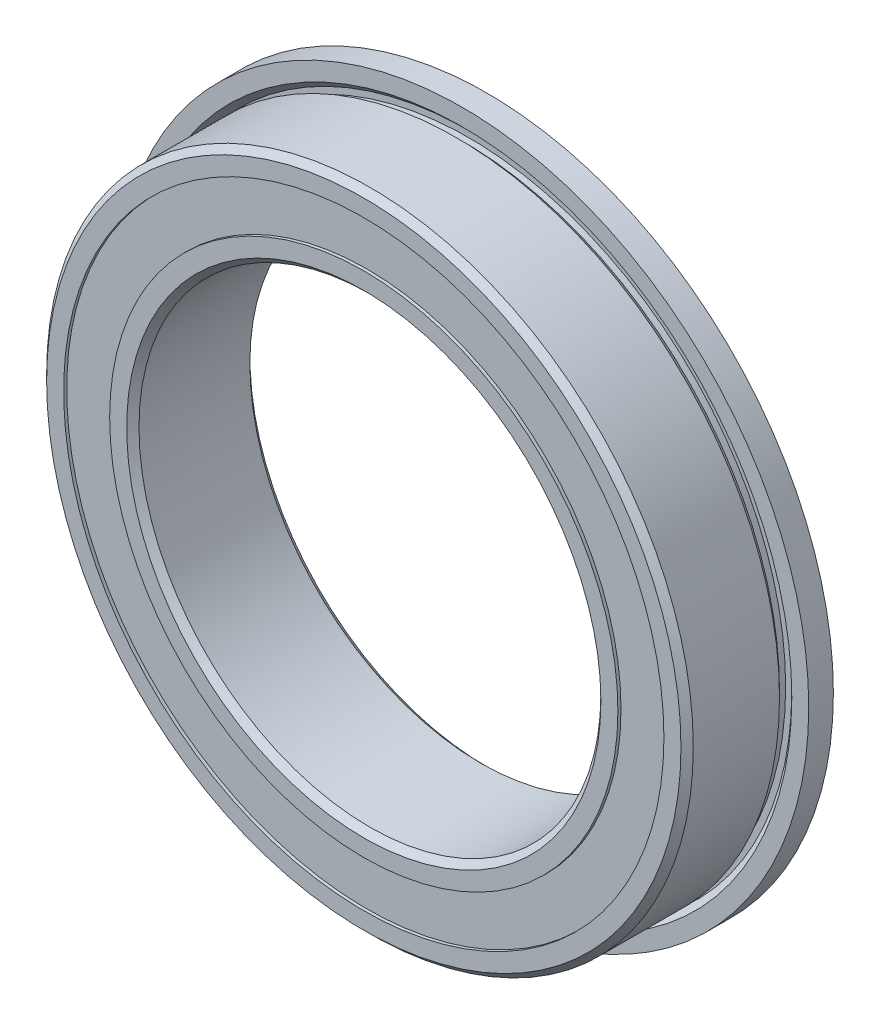
from build123d import *

# Parameters (mm, degrees)
SKETCH6_W         = 0.24908425
SKETCH6_H         = 0.747252748
CIRPATTERN1_COUNT = 13
SKETCH5_W         = 0.738746313
SKETCH5_H         = 1.494505494


with BuildPart() as part:
    # Sketch7 → Revolve7 (revolve)
    with BuildSketch(Plane(origin=(0, 0, 0), x_dir=(0, 0, -1), z_dir=(1, 0, 0))):
        with BuildLine():
            Line((2, 11.25), (1.2, 11.25))
            Line((1.2, 11.25), (1.2, 10.7))
            Line((1.2, 10.7), (1.4, 10.5))
            Line((1.4, 10.5), (1.4, 10.3))
            Line((1.4, 10.3), (1.2, 10.3))
            Line((1.2, 10.3), (1, 10.5))
            Line((1, 10.5), (-1.8, 10.5))
            Line((-1.8, 10.5), (-2, 10.3))
            Line((-2, 10.3), (-2, 9.747252747))
            Line((-2, 9.747252747), (-0.888888889, 9.747252747))
            ThreePointArc((-0.888888889, 9.747252747), (0, 10.161253687), (0.888888889, 9.747252747))
            Line((0.888888889, 9.747252747), (2, 9.747252747))
            Line((2, 9.747252747), (2, 10.3))
            Line((2, 10.3), (2, 11.25))
        make_face()
    revolve(axis=Axis((0, 0, 2), (0, 0, -1)))


with BuildPart() as body_2:
    # Sketch3 → Revolve3 (revolve)
    with BuildSketch(Plane(origin=(0, 0, 0), x_dir=(0, 0, -1), z_dir=(1, 0, 0))):
        with BuildLine():
            Line((-2, 8.252747253), (-0.888888889, 8.252747253))
            ThreePointArc((-0.888888889, 8.252747253), (0, 7.838746313), (0.888888889, 8.252747253))
            Line((0.888888889, 8.252747253), (2, 8.252747253))
            Line((2, 8.252747253), (2, 7.7))
            Line((2, 7.7), (1.8, 7.5))
            Line((1.8, 7.5), (-1.8, 7.5))
            Line((-1.8, 7.5), (-2, 7.7))
            Line((-2, 7.7), (-2, 8.252747253))
        make_face()
    revolve(axis=Axis((0, 0, 2), (0, 0, -1)))


with BuildPart() as body_3:
    # Sketch6 → Revolve6 (revolve)
    with BuildSketch(Plane(origin=(0, 0, 0), x_dir=(0, 0, -1), z_dir=(1, 0, 0))):
        with Locations((0, 9)):
            Rectangle(SKETCH6_W, SKETCH6_H)
    revolve(axis=Axis((0, 0, 2), (0, 0, -1)))


with BuildPart() as body_4:
    # Sketch4 → Revolve4 (revolve)
    with BuildSketch(Plane(origin=(0, 0, 0), x_dir=(0, 0, -1), z_dir=(1, 0, 0))):
        with BuildLine():
            Line((-1.161253687, 9), (1.161253687, 9))
            ThreePointArc((1.161253687, 9), (0, 10.161253687), (-1.161253687, 9))
        make_face()
    revolve(axis=Axis((0, 9, 1.161253687), (0, 0, -1)))


with BuildPart() as cirpattern1_1:
    # CirPattern1: pattern copy
    add(body_4.part.rotate(Axis((0, 0, -2), (0, 0, 1)), 1 * 360 / CIRPATTERN1_COUNT))


with BuildPart() as cirpattern1_2:
    # CirPattern1: pattern copy
    add(body_4.part.rotate(Axis((0, 0, -2), (0, 0, 1)), 2 * 360 / CIRPATTERN1_COUNT))


with BuildPart() as cirpattern1_3:
    # CirPattern1: pattern copy
    add(body_4.part.rotate(Axis((0, 0, -2), (0, 0, 1)), 3 * 360 / CIRPATTERN1_COUNT))


with BuildPart() as cirpattern1_4:
    # CirPattern1: pattern copy
    add(body_4.part.rotate(Axis((0, 0, -2), (0, 0, 1)), 4 * 360 / CIRPATTERN1_COUNT))


with BuildPart() as cirpattern1_5:
    # CirPattern1: pattern copy
    add(body_4.part.rotate(Axis((0, 0, -2), (0, 0, 1)), 5 * 360 / CIRPATTERN1_COUNT))


with BuildPart() as cirpattern1_6:
    # CirPattern1: pattern copy
    add(body_4.part.rotate(Axis((0, 0, -2), (0, 0, 1)), 6 * 360 / CIRPATTERN1_COUNT))


with BuildPart() as cirpattern1_7:
    # CirPattern1: pattern copy
    add(body_4.part.rotate(Axis((0, 0, -2), (0, 0, 1)), 7 * 360 / CIRPATTERN1_COUNT))


with BuildPart() as cirpattern1_8:
    # CirPattern1: pattern copy
    add(body_4.part.rotate(Axis((0, 0, -2), (0, 0, 1)), 8 * 360 / CIRPATTERN1_COUNT))


with BuildPart() as cirpattern1_9:
    # CirPattern1: pattern copy
    add(body_4.part.rotate(Axis((0, 0, -2), (0, 0, 1)), 9 * 360 / CIRPATTERN1_COUNT))


with BuildPart() as cirpattern1_10:
    # CirPattern1: pattern copy
    add(body_4.part.rotate(Axis((0, 0, -2), (0, 0, 1)), 10 * 360 / CIRPATTERN1_COUNT))


with BuildPart() as cirpattern1_11:
    # CirPattern1: pattern copy
    add(body_4.part.rotate(Axis((0, 0, -2), (0, 0, 1)), 11 * 360 / CIRPATTERN1_COUNT))


with BuildPart() as cirpattern1_12:
    # CirPattern1: pattern copy
    add(body_4.part.rotate(Axis((0, 0, -2), (0, 0, 1)), 12 * 360 / CIRPATTERN1_COUNT))


with BuildPart() as body_17:
    # Sketch5 → Revolve5 (revolve)
    with BuildSketch(Plane(origin=(0, 0, 0), x_dir=(0, 0, -1), z_dir=(1, 0, 0))):
        with Locations((-1.530626844, 9)):
            Rectangle(SKETCH5_W, SKETCH5_H)
        with Locations((1.530626844, 9)):
            Rectangle(SKETCH5_W, SKETCH5_H)
    revolve(axis=Axis((0, 0, 2), (0, 0, -1)))


solid = Compound([part.part, body_2.part, body_3.part, body_4.part, cirpattern1_1.part, cirpattern1_2.part, cirpattern1_3.part, cirpattern1_4.part, cirpattern1_5.part, cirpattern1_6.part, cirpattern1_7.part, cirpattern1_8.part, cirpattern1_9.part, cirpattern1_10.part, cirpattern1_11.part, cirpattern1_12.part, body_17.part])
